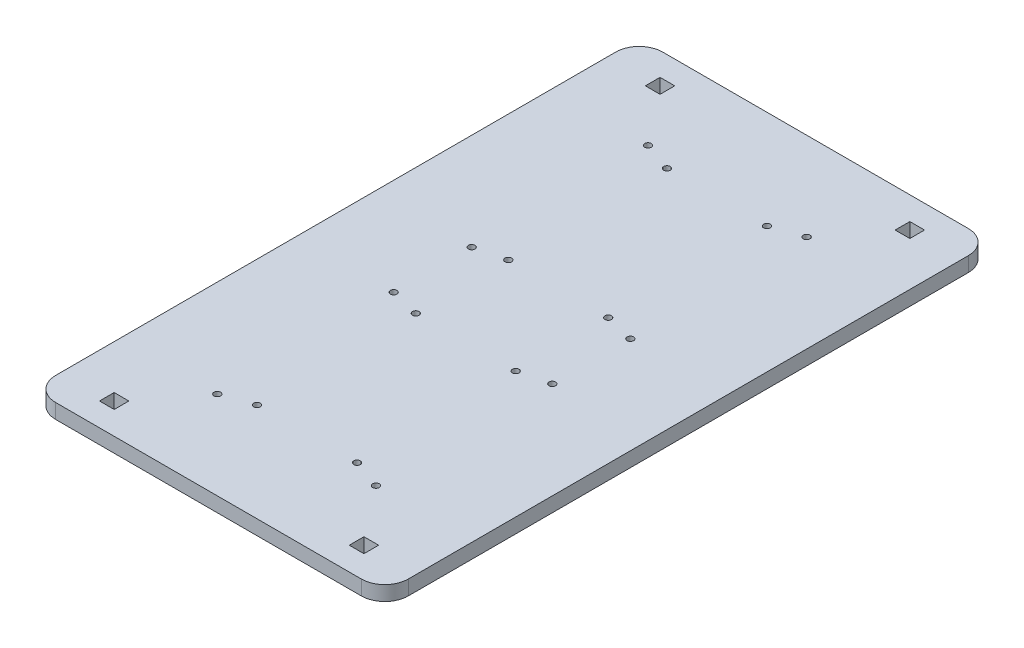
from build123d import *

# Parameters (mm, degrees)
SKETCH3_W           = 152.4
SKETCH3_H           = 262.339276313
SKETCH3_R           = 1.4224
SKETCH3_W_2         = 6.35
SKETCH3_H_2         = 6.35
BOSS_EXTRUDE1_DEPTH = 6.35
FILLET1_R           = 10.16


with BuildPart() as part:
    # Sketch3 → Boss-Extrude1 (new body)
    with BuildSketch(Plane(origin=(0, 0, 0), x_dir=(1, 0, 0), z_dir=(0, 1, 0))):
        with Locations((76.2, 131.169638157)):
            Rectangle(SKETCH3_W, SKETCH3_H)
        with Locations(Location((41.91, 38.1, 0), (0, 0, 270))):
            Circle(SKETCH3_R, mode=Mode.SUBTRACT)
        with Locations(Location((41.91, 114.3, 0), (0, 0, 270))):
            Circle(SKETCH3_R, mode=Mode.SUBTRACT)
        with Locations(Location((110.49, 114.3, 0), (0, 0, 90))):
            Circle(SKETCH3_R, mode=Mode.SUBTRACT)
        with Locations(Location((110.49, 38.1, 0), (0, 0, 90))):
            Circle(SKETCH3_R, mode=Mode.SUBTRACT)
        with Locations(Location((54.61, 151.157668748, 0), (0, 0, 270))):
            Circle(SKETCH3_R, mode=Mode.SUBTRACT)
        with Locations(Location((54.61, 219.737668748, 0), (0, 0, 270))):
            Circle(SKETCH3_R, mode=Mode.SUBTRACT)
        with Locations(Location((97.79, 151.157668748, 0), (0, 0, 90))):
            Circle(SKETCH3_R, mode=Mode.SUBTRACT)
        with Locations(Location((97.79, 219.737668748, 0), (0, 0, 90))):
            Circle(SKETCH3_R, mode=Mode.SUBTRACT)
        with Locations(Location((97.79, 42.601607565, 0), (0, 0, 270))):
            Circle(SKETCH3_R, mode=Mode.SUBTRACT)
        with Locations(Location((97.79, 111.181607565, 0), (0, 0, 270))):
            Circle(SKETCH3_R, mode=Mode.SUBTRACT)
        with Locations(Location((54.61, 111.181607565, 0), (0, 0, 90))):
            Circle(SKETCH3_R, mode=Mode.SUBTRACT)
        with Locations(Location((54.61, 42.601607565, 0), (0, 0, 90))):
            Circle(SKETCH3_R, mode=Mode.SUBTRACT)
        with Locations(Location((110.49, 148.039276313, 0), (0, 0, 270))):
            Circle(SKETCH3_R, mode=Mode.SUBTRACT)
        with Locations(Location((110.49, 224.239276313, 0), (0, 0, 270))):
            Circle(SKETCH3_R, mode=Mode.SUBTRACT)
        with Locations(Location((41.91, 224.239276313, 0), (0, 0, 90))):
            Circle(SKETCH3_R, mode=Mode.SUBTRACT)
        with Locations(Location((41.91, 148.039276313, 0), (0, 0, 90))):
            Circle(SKETCH3_R, mode=Mode.SUBTRACT)
        with Locations((22.225, 13.212735966)):
            Rectangle(SKETCH3_W_2, SKETCH3_H_2, mode=Mode.SUBTRACT)
        with Locations((130.175, 13.212735966)):
            Rectangle(SKETCH3_W_2, SKETCH3_H_2, mode=Mode.SUBTRACT)
        with Locations((130.175, 249.126540348)):
            Rectangle(SKETCH3_W_2, SKETCH3_H_2, mode=Mode.SUBTRACT)
        with Locations((22.225, 249.126540348)):
            Rectangle(SKETCH3_W_2, SKETCH3_H_2, mode=Mode.SUBTRACT)
    extrude(amount=BOSS_EXTRUDE1_DEPTH)

    # Fillet1
    fillet1_edges = [part.edges().sort_by_distance(p)[0] for p in [
        (0, 3.175, -262.339276313),
        (152.4, 3.175, -262.339276313),
        (152.4, 3.175, 0),
        (0, 3.175, 0),
    ]]
    fillet(fillet1_edges, radius=FILLET1_R)


solid = part.part
